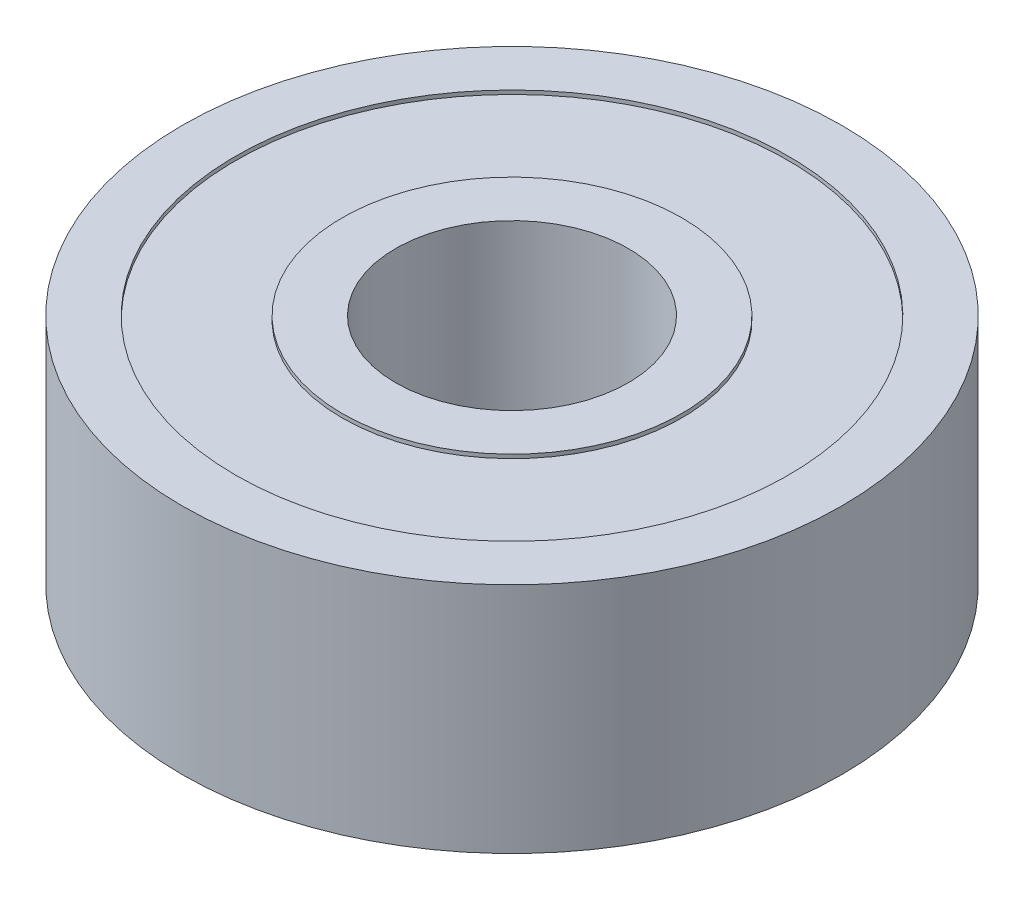
from build123d import *

# Parameters (mm, degrees)
SKETCH1_R      = 8.5
SKETCH1_R_2    = 3
EXTRUDE1_DEPTH = 6
SKETCH2_R      = 7.125
SKETCH2_R_2    = 4.375
EXTRUDE2_DEPTH = 0.1
EXTRUDE3_START = -0.1
SKETCH3_R      = 7.125
SKETCH3_R_2    = 4.375
EXTRUDE3_DEPTH = 0.1


with BuildPart() as part:
    # Sketch1 → Extrude1 (new body)
    with BuildSketch(Plane(origin=(0, 0, 0), x_dir=(1, 0, 0), z_dir=(0, 1, 0))):
        Circle(SKETCH1_R)
        Circle(SKETCH1_R_2, mode=Mode.SUBTRACT)
    extrude(amount=EXTRUDE1_DEPTH)

    # Sketch2 → Extrude2 (cut)
    with BuildSketch(Plane(origin=(0, 6, 0), x_dir=(1, 0, 0), z_dir=(0, 1, 0))):
        Circle(SKETCH2_R)
        Circle(SKETCH2_R_2, mode=Mode.SUBTRACT)
    extrude(amount=-EXTRUDE2_DEPTH, mode=Mode.SUBTRACT)

    # Sketch3 → Extrude3 (cut)
    with BuildSketch(Plane.XZ.offset(EXTRUDE3_START)):
        Circle(SKETCH3_R)
        Circle(SKETCH3_R_2, mode=Mode.SUBTRACT)
    extrude(amount=EXTRUDE3_DEPTH, mode=Mode.SUBTRACT)


solid = part.part
